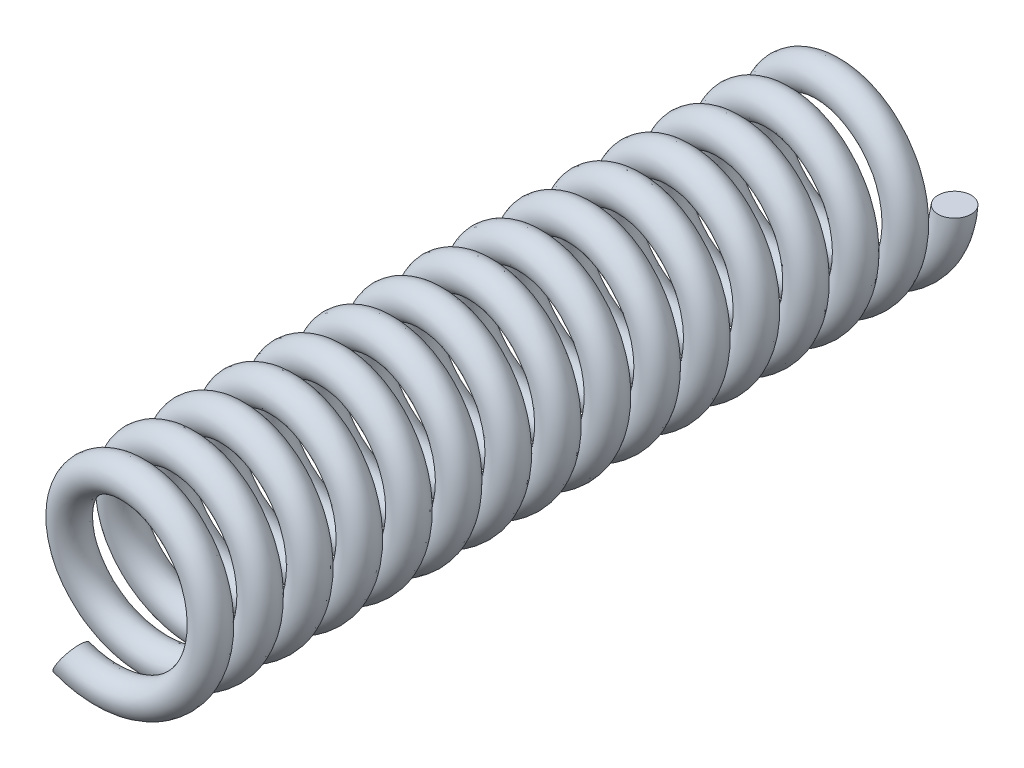
from build123d import *

# Parameters (mm, degrees)
SWEEP1_PITCH  = 1.5
SWEEP1_HEIGHT = 22.995
SWEEP1_RADIUS = 2.5
SKETCH2_R     = 0.5


with BuildPart() as part:
    # Sweep1: sweep along a helix
    with BuildLine() as sweep1_path:
        Helix(SWEEP1_PITCH, SWEEP1_HEIGHT, SWEEP1_RADIUS, center=(0, 0, 0), direction=(0, 0, 1), lefthand=True)
    # Sketch2 → Sweep1 (sweep)
    with BuildSketch(Plane(origin=(0, 0, 0), x_dir=(1, 0, 0), z_dir=(0, 1, 0))):
        with Locations((2.5, 0)):
            Circle(SKETCH2_R)
    sweep(path=sweep1_path.line, is_frenet=True)


solid = part.part
